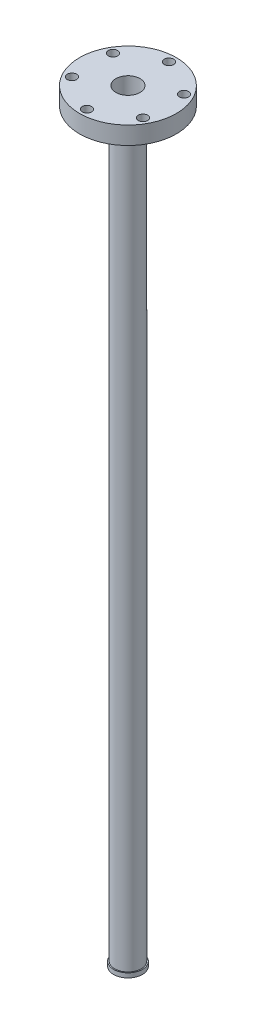
from build123d import *

# Parameters (mm, degrees)
SKETCH1_R         = 9.525
SKETCH1_R_2       = 8.636
EXTRUDE1_DEPTH    = 546.1
EXTRUDE2_START    = -12.7
SKETCH2_R         = 34.671
SKETCH2_R_2       = 8.636
EXTRUDE2_DEPTH    = 12.7
SKETCH3_R         = 3.3655
EXTRUDE3_DEPTH    = 549.296786861
CIRPATTERN1_COUNT = 6
SKETCH4_R         = 10.31875
SKETCH4_R_2       = 8.636
EXTRUDE4_DEPTH    = 3.175


with BuildPart() as part:
    # Sketch1 → Extrude1 (new body)
    with BuildSketch(Plane(origin=(0, 0, 0), x_dir=(1, 0, 0), z_dir=(0, 1, 0))):
        with Locations(Location((0, 0, 0), (0, 0, 270))):
            Circle(SKETCH1_R)
        with Locations(Location((0, 0, 0), (0, 0, 270))):
            Circle(SKETCH1_R_2, mode=Mode.SUBTRACT)
    extrude(amount=EXTRUDE1_DEPTH)

    # Sketch2 → Extrude2 (add)
    with BuildSketch(Plane(origin=(0, 546.1, 0), x_dir=(1, 0, 0), z_dir=(0, 1, 0)).offset(EXTRUDE2_START)):
        with Locations(Location((0, 0, 0), (0, 0, 270))):
            Circle(SKETCH2_R)
        with Locations(Location((0, 0, 0), (0, 0, 270))):
            Circle(SKETCH2_R_2, mode=Mode.SUBTRACT)
    extrude(amount=EXTRUDE2_DEPTH)

    # Sketch3 → Extrude3 (cut, through all)
    with BuildSketch(Plane(origin=(0, 546.1, 0), x_dir=(1, 0, 0), z_dir=(0, 1, 0))):
        with Locations(Location((0, 29.3624, 0), (0, 0, 270))):
            Circle(SKETCH3_R)
    extrude3 = extrude(amount=-EXTRUDE3_DEPTH, mode=Mode.SUBTRACT)

    # CirPattern1: Extrude3 ×6 about axis
    cirpattern1_axis = Axis((0, 0, 0), (0, 1, 0))
    for i in range(1, CIRPATTERN1_COUNT):
        add(extrude3.rotate(cirpattern1_axis, i * 360 / CIRPATTERN1_COUNT), mode=Mode.SUBTRACT)

    # Sketch4 → Extrude4 (add)
    with BuildSketch(Plane.XZ):
        with Locations(Location((0, 0, 0), (0, 0, 270))):
            Circle(SKETCH4_R)
        with Locations(Location((0, 0, 0), (0, 0, 90))):
            Circle(SKETCH4_R_2, mode=Mode.SUBTRACT)
    extrude(amount=-EXTRUDE4_DEPTH)


solid = part.part
